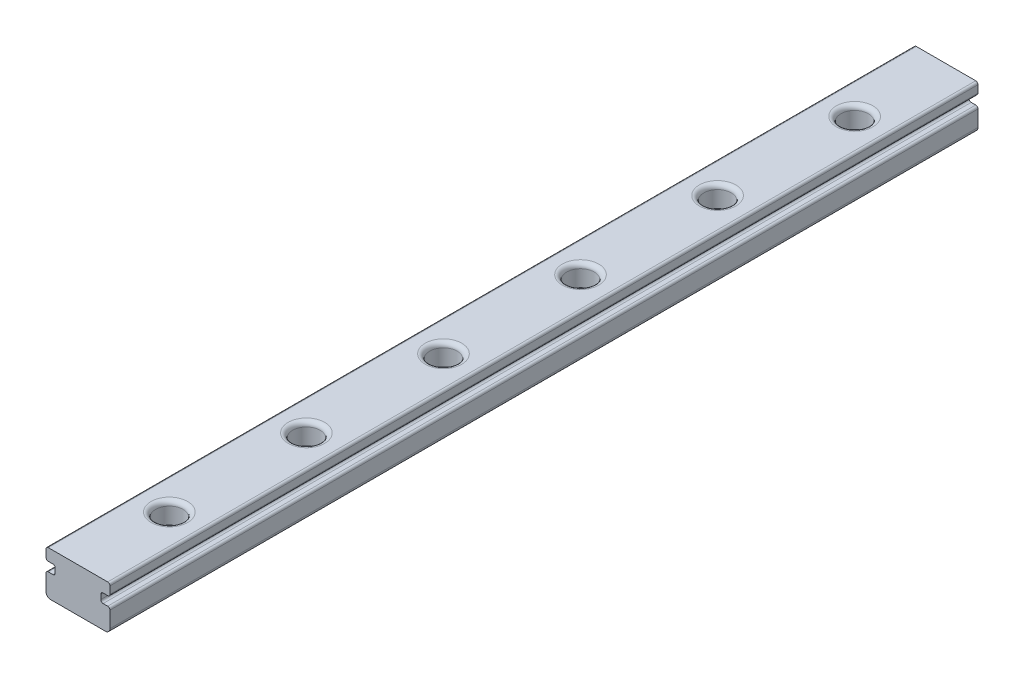
from build123d import *

# Parameters (mm, degrees)
EXTRUDE_1_DEPTH                = 95
FILLET_1_R                     = 0.25
FILLET_2_R                     = 0.5
SKETCH_2_R                     = 1.5
CUT_EXTRUDE_1_DEPTH            = 2.3
SKETCH_3_R                     = 1.2
CUT_EXTRUDE_2_DEPTH            = 96.290345786
FILLET_3_R                     = 0.5
PATTERN_LINEAR_2_COUNT         = 6
PATTERN_LINEAR_2_PITCH         = 15
FILLET_3_OF_PATTERN_LINEAR_2_R = 0.5


with BuildPart() as part:
    # 草图1 → 凸台-拉伸1 (new body)
    with BuildSketch(Plane.XY):
        Polygon((7, 2.5), (7, 0), (0, 0), (0, 2.5), (1, 2.5), (1, 3.5), (0, 3.5), (0, 4.8), (7, 4.8), (7, 3.5), (6, 3.5), (6, 2.5), align=None)
    extrude(amount=EXTRUDE_1_DEPTH)

    # 圆角1
    fillet_1_edges = [part.edges().sort_by_distance(p)[0] for p in [
        (0, 2.5, 47.5),
        (1, 2.5, 47.5),
        (1, 3.5, 47.5),
        (0, 3.5, 47.5),
        (0, 4.8, 47.5),
        (7, 4.8, 47.5),
        (7, 3.5, 47.5),
        (6, 3.5, 47.5),
        (6, 2.5, 47.5),
        (7, 2.5, 47.5),
    ]]
    fillet(fillet_1_edges, radius=FILLET_1_R)

    # 圆角2
    fillet_2_edges = [part.edges().sort_by_distance(p)[0] for p in [
        (7, 0, 47.5),
        (0, 0, 47.5),
    ]]
    fillet(fillet_2_edges, radius=FILLET_2_R)

    # 草图2 → 切除-拉伸1 (cut)
    with BuildSketch(Plane(origin=(0, 4.8, 0), x_dir=(1, 0, 0), z_dir=(0, 1, 0))):
        with Locations(Location((3.5, -10, 0), (0, 0, 270))):
            Circle(SKETCH_2_R)
    cut_extrude_1 = extrude(amount=-CUT_EXTRUDE_1_DEPTH, mode=Mode.SUBTRACT)

    # 草图3 → 切除-拉伸2 (cut, through all)
    with BuildSketch(Plane(origin=(0, 2.5, 0), x_dir=(1, 0, 0), z_dir=(0, 1, 0))):
        with Locations(Location((3.5, -10, 0), (0, 0, 270))):
            Circle(SKETCH_3_R)
    cut_extrude_2 = extrude(amount=-CUT_EXTRUDE_2_DEPTH, mode=Mode.SUBTRACT)

    # 圆角3
    fillet_3_edges = [part.edges().sort_by_distance(p)[0] for p in [
        (3.5, 4.8, 8.5),
    ]]
    fillet(fillet_3_edges, radius=FILLET_3_R)

    # 阵列(线性)2: 切除-拉伸1, 切除-拉伸2 ×6
    with Locations(*[(0, 0, i * PATTERN_LINEAR_2_PITCH) for i in range(1, PATTERN_LINEAR_2_COUNT)]):
        add(cut_extrude_1, mode=Mode.SUBTRACT)
        add(cut_extrude_2, mode=Mode.SUBTRACT)

    # 圆角3 of 阵列(线性)2
    fillet_3_of_pattern_linear_2_edges = [part.edges().sort_by_distance(p)[0] for p in [
        (3.5, 4.8, 23.5),
        (3.5, 4.8, 38.5),
        (3.5, 4.8, 53.5),
        (3.5, 4.8, 68.5),
        (3.5, 4.8, 83.5),
    ]]
    fillet(fillet_3_of_pattern_linear_2_edges, radius=FILLET_3_OF_PATTERN_LINEAR_2_R)


solid = part.part
